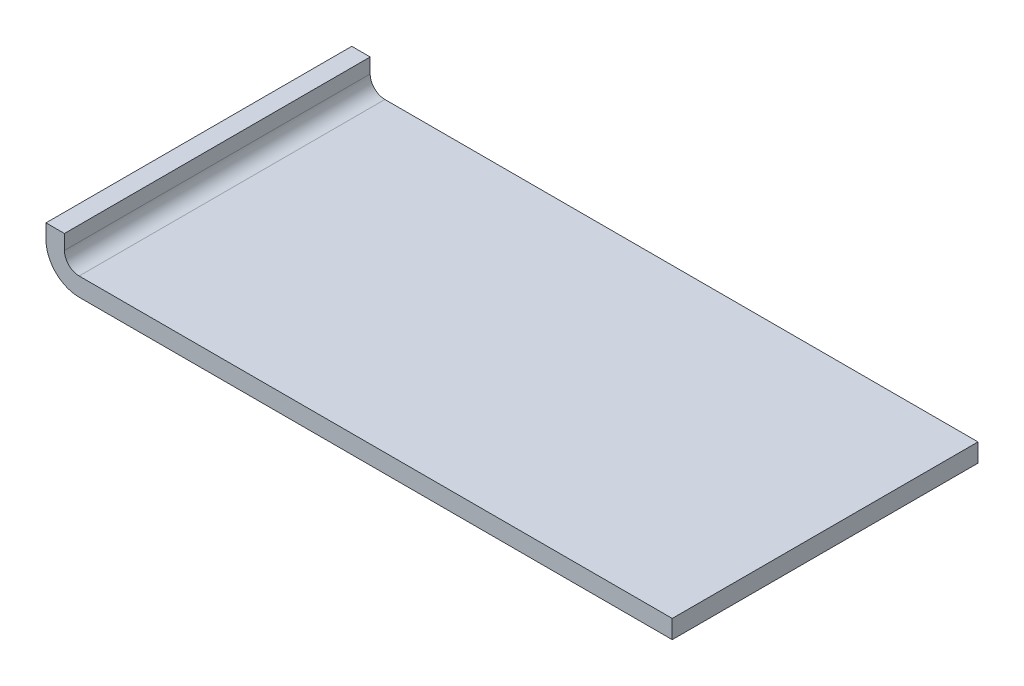
from build123d import *

# Parameters (mm, degrees)
BOSS_EXTRUDE2_DEPTH = 4.15


with BuildPart() as part:
    # Sketch2 → Boss-Extrude2 (new, symmetric)
    with BuildSketch(Plane.XY):
        with BuildLine():
            Line((-0.5, 0.399999956), (-0.5, 0.8))
            Line((-0.5, 0.8), (0, 0.8))
            Line((0, 0.8), (0, 0.4))
            ThreePointArc((0, 0.4), (0.117157259, 0.11715729), (0.399999956, 0))
            Line((0.399999956, 0), (16.5, 0))
            Line((16.5, 0), (16.5, -0.5))
            Line((16.5, -0.5), (0.399999956, -0.5))
            ThreePointArc((0.399999956, -0.5), (-0.236396116, -0.236396116), (-0.5, 0.399999956))
        make_face()
    extrude(amount=BOSS_EXTRUDE2_DEPTH, both=True)


solid = part.part
